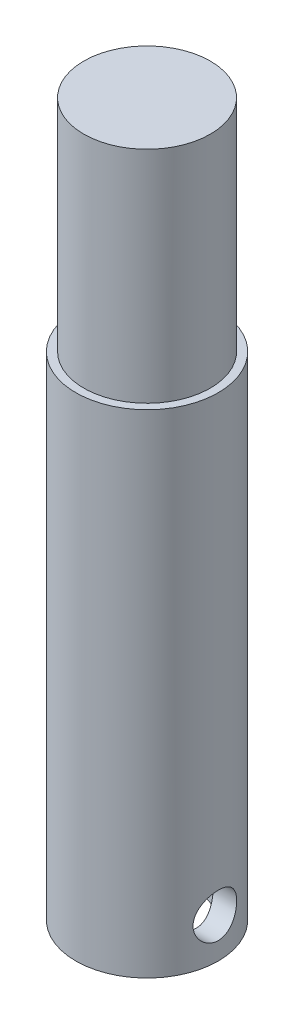
from build123d import *

# Parameters (mm, degrees)
BOSS_EXTRUDE1_DEPTH      = 57.15
BOSS_EXTRUDE2_DEPTH      = 57.15
BOSS_EXTRUDE3_START      = -6.35
BOSS_EXTRUDE3_DEPTH      = 6.35
SKETCH5_R                = 3.96875
CUT_EXTRUDE1_DEPTH       = 6.35
BOSS_EXTRUDE4_DEPTH      = 6.35
BOSS_EXTRUDE4_DEPTH_BACK = 33.147
SKETCH7_R                = 5.715
SKETCH7_R_2              = 3.96875
CUT_EXTRUDE2_DEPTH       = 59.440702853
CUT_EXTRUDE2_DEPTH_BACK  = 59.440702853
SKETCH6_R                = 1.75


with BuildPart() as part:
    # Sketch1 → Boss-Extrude1 (new body)
    with BuildSketch(Plane(origin=(0, 0, 0), x_dir=(1, 0, 0), z_dir=(0, 1, 0))):
        with BuildLine():
            Line((-4.099560952, 3), (4.099560952, 3))
            ThreePointArc((4.099560952, 3), (0, -5.08), (-4.099560952, 3))
        make_face()
    extrude(amount=BOSS_EXTRUDE1_DEPTH)

    # Sketch3 → Boss-Extrude2 (add)
    with BuildSketch(Plane.XZ):
        with BuildLine():
            Line((-4.099560952, -3), (4.099560952, -3))
            ThreePointArc((4.099560952, -3), (0, -5.08), (-4.099560952, -3))
        make_face()
    extrude(amount=-BOSS_EXTRUDE2_DEPTH)

    # Sketch4 → Boss-Extrude3 (add)
    with BuildSketch(Plane(origin=(0, 57.15, 0), x_dir=(1, 0, 0), z_dir=(0, 1, 0)).offset(BOSS_EXTRUDE3_START)):
        with BuildLine():
            Line((-4.099560952, 3), (4.099560952, 3))
            ThreePointArc((4.099560952, 3), (0, 5.08), (-4.099560952, 3))
        make_face()
    extrude(amount=BOSS_EXTRUDE3_DEPTH)

    # Sketch5 → Cut-Extrude1 (cut)
    with BuildSketch(Plane.XZ):
        with Locations(Location((0, 0, 0), (0, 0, 270))):
            Circle(SKETCH5_R)
    extrude(amount=-CUT_EXTRUDE1_DEPTH, mode=Mode.SUBTRACT)

    # Sketch7 → Boss-Extrude4 (add, two sides: drawn at the far end of the back side and taken through both)
    with BuildSketch(Plane(origin=(0, 6.35, 0), x_dir=(-1, 0, 0), z_dir=(0, -1, 0)).offset(-BOSS_EXTRUDE4_DEPTH_BACK)):
        with Locations(Location((0, 0, 0), (0, 0, 90))):
            Circle(SKETCH7_R)
        with Locations(Location((0, 0, 0), (0, 0, 90))):
            Circle(SKETCH7_R_2, mode=Mode.SUBTRACT)
    extrude(amount=BOSS_EXTRUDE4_DEPTH + BOSS_EXTRUDE4_DEPTH_BACK)

    # Sketch6 → Cut-Extrude2 (cut, two sides: drawn at the far end of the back side and taken through both)
    with BuildSketch(Plane(origin=(5.08, 0, 0), x_dir=(0, 0, -1), z_dir=(1, 0, 0)).offset(-CUT_EXTRUDE2_DEPTH_BACK)):
        with Locations((0, 3.175)):
            Circle(SKETCH6_R)
    extrude(amount=CUT_EXTRUDE2_DEPTH + CUT_EXTRUDE2_DEPTH_BACK, mode=Mode.SUBTRACT)


solid = part.part
